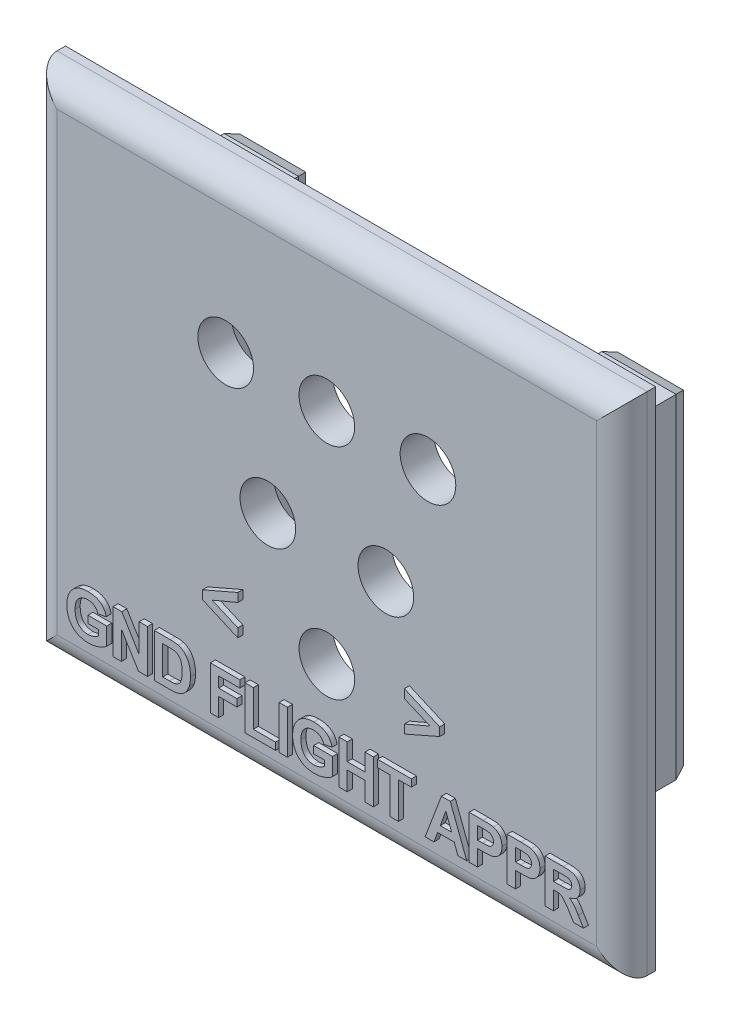
from build123d import *
from OCP.BRepFilletAPI import BRepFilletAPI_MakeChamfer

# Parameters (mm, degrees)
SKETCH2_W           = 53.6
SKETCH2_H           = 39.6
BOSS_EXTRUDE1_DEPTH = 12
SKETCH3_W           = 70
SKETCH3_H           = 60
BOSS_EXTRUDE2_DEPTH = 4
SKETCH4_R           = 2.1
CUT_EXTRUDE1_DEPTH  = 63.93679369
SKETCH5_W           = 36
SKETCH5_H           = 39.6
CUT_EXTRUDE2_DEPTH  = 12
CHAMFER1_SIZE       = 0.5
CHAMFER1_SIZE2      = 1.37373871
FILLET1_R           = 3
SKETCH7_R           = 3.3
CUT_EXTRUDE3_DEPTH  = 49.795491595
SKETCH8_W           = 0.987814879
SKETCH8_H           = 5.13663737
BOSS_EXTRUDE3_DEPTH = 0.6
BOSS_EXTRUDE4_DEPTH = 0.6


with BuildPart() as part:
    # Sketch2 → Boss-Extrude1 (new body)
    with BuildSketch(Plane.XY):
        Rectangle(SKETCH2_W, SKETCH2_H)
    extrude(amount=BOSS_EXTRUDE1_DEPTH)

    # Sketch3 → Boss-Extrude2 (add)
    with BuildSketch(Plane.XY.offset(12)):
        Rectangle(SKETCH3_W, SKETCH3_H)
    extrude(amount=BOSS_EXTRUDE2_DEPTH)

    # Sketch4 → Cut-Extrude1 (cut, through all)
    with BuildSketch(Plane(origin=(0, 19.8, 0), x_dir=(1, 0, 0), z_dir=(0, 1, 0))):
        with Locations(Location((22.5, -4.6, 0), (0, 0, 180))):
            Circle(SKETCH4_R)
        with Locations(Location((-22.5, -4.6, 0), (0, 0, 180))):
            Circle(SKETCH4_R)
    extrude(amount=-CUT_EXTRUDE1_DEPTH, mode=Mode.SUBTRACT)

    # Sketch5 → Cut-Extrude2 (cut)
    with BuildSketch(Plane(origin=(0, 0, 0), x_dir=(-1, 0, 0), z_dir=(0, 0, -1))):
        Rectangle(SKETCH5_W, SKETCH5_H)
    extrude(amount=-CUT_EXTRUDE2_DEPTH, mode=Mode.SUBTRACT)

    # Chamfer1: one chamfer whose edges measure the first distance from different faces: ONE call of the kernel's chamfer builder (chamfer() names one face for all edges)
    chamfer1_edges_1 = [part.edges().sort_by_distance(p)[0] for p in [
        (-22.4, 19.8, 0),
        (-18, 0, 0),
        (-22.4, -19.8, 0),
        (-26.8, 0, 0),
    ]]
    chamfer1_side_1 = [part.faces().sort_by_distance(p)[0] for p in [
        (-22.4, 0, 0),
    ]]
    chamfer1_edges_2 = [part.edges().sort_by_distance(p)[0] for p in [
        (22.4, -19.8, 0),
        (18, 0, 0),
        (22.4, 19.8, 0),
        (26.8, 0, 0),
    ]]
    chamfer1_side_2 = [part.faces().sort_by_distance(p)[0] for p in [
        (22.4, 0, 0),
    ]]
    chamfer1 = BRepFilletAPI_MakeChamfer(part.part.solid().wrapped)
    for e in chamfer1_edges_1:
        chamfer1.Add(CHAMFER1_SIZE, CHAMFER1_SIZE2, e.wrapped, chamfer1_side_1[0].wrapped)  # the first distance lies on this face
    for e in chamfer1_edges_2:
        chamfer1.Add(CHAMFER1_SIZE, CHAMFER1_SIZE2, e.wrapped, chamfer1_side_2[0].wrapped)  # the first distance lies on this face
    add(Compound.cast(chamfer1.Shape()), mode=Mode.REPLACE)

    # Fillet1
    fillet1_edges = [part.edges().sort_by_distance(p)[0] for p in [
        (-35, 0, 16),
        (0, -30, 16),
        (35, 0, 16),
        (0, 30, 16),
    ]]
    fillet(fillet1_edges, radius=FILLET1_R)

    # Sketch7 → Cut-Extrude3 (cut, through all)
    with BuildSketch(Plane.XY.offset(16)):
        with Locations((0, 12)):
            Circle(SKETCH7_R)
        with Locations((-12, 12)):
            Circle(SKETCH7_R)
        with Locations((12, 12)):
            Circle(SKETCH7_R)
        with Locations((-7, -2)):
            Circle(SKETCH7_R)
        with Locations((7, -2)):
            Circle(SKETCH7_R)
        with Locations((0, -14)):
            Circle(SKETCH7_R)
    extrude(amount=-CUT_EXTRUDE3_DEPTH, mode=Mode.SUBTRACT)

    # Sketch8 → Boss-Extrude3 (add)
    # profile 1 of 13: a face of its own
    with BuildSketch(Plane.XY.offset(16)):
        with BuildLine():
            Line((-27.744427229, -23.396296304), (-27.744427229, -22.540190076))
            Line((-27.744427229, -22.540190076), (-25.505380171, -22.540190076))
            Line((-25.505380171, -22.540190076), (-25.505380171, -24.604311583))
            add(Edge.make_bspline(
                [(-25.505380171, -24.604311583), (-25.533559843, -24.629686695), (-25.591164795, -24.681558559), (-25.685153774, -24.754710862), (-25.788626788, -24.82454927), (-25.900958318, -24.892488188), (-26.022380836, -24.957980806), (-26.152410045, -25.02193927), (-26.291285854, -25.083738088), (-26.487676551, -25.161153742), (-26.740471637, -25.245388371), (-27.049518684, -25.318633118), (-27.361010494, -25.363557013), (-27.569356657, -25.369138195), (-27.673428035, -25.371926062)],
                knots=[0, 0, 0, 0, 0.581799769, 1.189316438, 1.825828404, 2.496525428, 3.203088405, 3.942228803, 4.719818701, 5.534979611, 7.181138583, 8.803804008, 10.403462225, 12, 12, 12, 12], degree=3))
            add(Edge.make_bspline(
                [(-27.673428035, -25.371926062), (-27.738625354, -25.370946336), (-27.867148662, -25.369015004), (-28.05687835, -25.353469804), (-28.240044276, -25.32687204), (-28.416795708, -25.28920833), (-28.587730934, -25.243805577), (-28.75213744, -25.185887339), (-28.909431529, -25.11636112), (-29.06103829, -25.038888507), (-29.204131407, -24.949904906), (-29.338849114, -24.852564786), (-29.464216345, -24.74602147), (-29.579783662, -24.630060197), (-29.687098685, -24.505479616), (-29.78490929, -24.371685649), (-29.872623978, -24.228523835), (-29.951325468, -24.077789983), (-30.021341557, -23.920809753), (-30.080422868, -23.758818661), (-30.132219552, -23.594168641), (-30.174790766, -23.426281642), (-30.206057241, -23.254611836), (-30.230363158, -23.07995353), (-30.243417793, -22.901215446), (-30.245725794, -22.780988404), (-30.246891589, -22.720260497)],
                knots=[0, 0, 0, 0, 1.124918047, 2.217548049, 3.282233239, 4.316494221, 5.334437038, 6.332151046, 7.320712088, 8.300141923, 9.267552434, 10.225301062, 11.165776911, 12.103230934, 13.047553934, 14.000517593, 14.959782875, 15.941944936, 16.932894943, 17.923491392, 18.915624898, 19.910402922, 20.909870877, 21.92519501, 22.95199481, 24, 24, 24, 24], degree=3))
            add(Edge.make_bspline(
                [(-30.246891589, -22.720260497), (-30.245946144, -22.654715766), (-30.244082263, -22.525498775), (-30.228018222, -22.334517564), (-30.203072667, -22.14913281), (-30.165244364, -21.969681072), (-30.119222425, -21.795327012), (-30.063055262, -21.626185452), (-29.994238091, -21.463509565), (-29.917685248, -21.305908113), (-29.830540074, -21.155560563), (-29.73207093, -21.014395368), (-29.625191784, -20.880988723), (-29.507790618, -20.757459679), (-29.380280863, -20.64386843), (-29.243958722, -20.538958736), (-29.099150654, -20.440922082), (-28.995507605, -20.385644404), (-28.943181744, -20.357736578)],
                knots=[0, 0, 0, 0, 1.105010302, 2.178452875, 3.229459892, 4.257086284, 5.268538906, 6.268935615, 7.259234261, 8.24469117, 9.221745683, 10.185929258, 11.144249683, 12.101504986, 13.055838221, 14.020611351, 15.000673771, 16, 16, 16, 16], degree=3))
            add(Edge.make_bspline(
                [(-28.943181744, -20.357736578), (-28.901655779, -20.337117391), (-28.817313136, -20.295238129), (-28.683123639, -20.245237234), (-28.542780009, -20.199741275), (-28.394163364, -20.16579571), (-28.238282928, -20.137906806), (-28.075207785, -20.117094358), (-27.904413298, -20.106164939), (-27.78834421, -20.104454612), (-27.728992622, -20.103580042)],
                knots=[0, 0, 0, 0, 0.887969848, 1.803539625, 2.741143579, 3.713741423, 4.722068772, 5.775476617, 6.8624965, 8, 8, 8, 8], degree=3))
            add(Edge.make_bspline(
                [(-27.728992622, -20.103580042), (-27.652469567, -20.10471986), (-27.503646374, -20.106936595), (-27.286673301, -20.125407706), (-27.082473285, -20.157242058), (-26.890761963, -20.201086624), (-26.711952343, -20.257459098), (-26.546352239, -20.326762248), (-26.392945238, -20.407601366), (-26.253953255, -20.50321626), (-26.126551462, -20.608642869), (-26.011072311, -20.724009431), (-25.907469322, -20.849486829), (-25.815673953, -20.984443694), (-25.736408695, -21.129437859), (-25.668255713, -21.283146944), (-25.612157557, -21.44673786), (-25.585046562, -21.560348853), (-25.571234496, -21.618229522)],
                knots=[0, 0, 0, 0, 1.271135529, 2.472123572, 3.614091059, 4.701890498, 5.736279567, 6.724681829, 7.680621489, 8.611506429, 9.52200816, 10.424540711, 11.318996785, 12.221421405, 13.131851814, 14.060431888, 15.011860567, 16, 16, 16, 16], degree=3))
            Line((-25.571234496, -21.618229522), (-26.559049375, -21.815792498))
            add(Edge.make_bspline(
                [(-26.559049375, -21.815792498), (-26.568830617, -21.783377757), (-26.588128825, -21.719424078), (-26.625539665, -21.627622787), (-26.668628739, -21.541323503), (-26.717499405, -21.45990158), (-26.772643997, -21.38385829), (-26.835394803, -21.314013912), (-26.901804426, -21.247182564), (-26.976210034, -21.188016012), (-27.055520465, -21.134677634), (-27.138842061, -21.086580217), (-27.228057536, -21.047574552), (-27.321917209, -21.016190251), (-27.419962332, -20.989536699), (-27.523472433, -20.973144662), (-27.631285112, -20.960781898), (-27.704944622, -20.960055391), (-27.742369282, -20.95968627)],
                knots=[0, 0, 0, 0, 1.027736275, 2.027704492, 3.005900071, 3.954421694, 4.908588141, 5.853155543, 6.803277083, 7.766271258, 8.734041521, 9.704274878, 10.683578894, 11.68490234, 12.708089448, 13.76461009, 14.864251086, 16, 16, 16, 16], degree=3))
            add(Edge.make_bspline(
                [(-27.742369282, -20.95968627), (-27.799012815, -20.961197538), (-27.909557497, -20.964146906), (-28.070938001, -20.983392168), (-28.223185701, -21.017631255), (-28.366698716, -21.064857546), (-28.501740147, -21.125475798), (-28.626485166, -21.201746945), (-28.744039849, -21.289157906), (-28.851059001, -21.391748663), (-28.948113212, -21.506782216), (-29.032130993, -21.635630668), (-29.102075436, -21.777877528), (-29.159363921, -21.932808533), (-29.204977779, -22.100430141), (-29.235921643, -22.281335739), (-29.256139801, -22.475247795), (-29.258077649, -22.609076791), (-29.25907671, -22.67807257)],
                knots=[0, 0, 0, 0, 1.043810997, 2.037086103, 2.989314757, 3.91471467, 4.817033861, 5.710208705, 6.603920097, 7.511448416, 8.435617211, 9.371747005, 10.338444094, 11.350425613, 12.411431869, 13.5347293, 14.729025275, 16, 16, 16, 16], degree=3))
            add(Edge.make_bspline(
                [(-29.25907671, -22.67807257), (-29.258034893, -22.752203746), (-29.25601006, -22.896282015), (-29.236321866, -23.105042113), (-29.203934614, -23.299540026), (-29.157480667, -23.479530422), (-29.099027135, -23.64565188), (-29.028763375, -23.798435082), (-28.942049404, -23.935044965), (-28.844373528, -24.058219839), (-28.735201703, -24.165849271), (-28.617595321, -24.259683546), (-28.492209145, -24.339204691), (-28.357886926, -24.403157488), (-28.216322773, -24.454065562), (-28.066215234, -24.489755657), (-27.908011266, -24.511925029), (-27.799723587, -24.514503272), (-27.744427229, -24.515819834)],
                knots=[0, 0, 0, 0, 1.318042826, 2.561693173, 3.724929596, 4.821196409, 5.862977565, 6.853497791, 7.804600806, 8.73339865, 9.643480846, 10.524649628, 11.404635349, 12.277659519, 13.165160235, 14.075017549, 15.017020959, 16, 16, 16, 16], degree=3))
            add(Edge.make_bspline(
                [(-27.744427229, -24.515819834), (-27.688420236, -24.514263015), (-27.575870467, -24.511134484), (-27.40729181, -24.484623351), (-27.238053573, -24.445611367), (-27.072127594, -24.386761063), (-26.910985566, -24.319260179), (-26.760542273, -24.241466602), (-26.619656765, -24.160376994), (-26.534827277, -24.097175841), (-26.49319505, -24.066158269)],
                knots=[0, 0, 0, 0, 0.993821502, 1.997150276, 3.023717651, 4.073291794, 5.118404464, 6.123376694, 7.078999408, 8, 8, 8, 8], degree=3))
            Line((-26.49319505, -24.066158269), (-26.49319505, -23.396296304))
            Line((-26.49319505, -23.396296304), (-27.744427229, -23.396296304))
        make_face()
    # profile 2 of 13: a face of its own
    with BuildSketch(Plane.XY.offset(16)):
        Polygon((-24.754640863, -25.306071737), (-24.754640863, -20.169434367), (-23.722580109, -20.169434367), (-21.659487576, -23.546526484), (-21.659487576, -20.169434367), (-20.671672697, -20.169434367), (-20.671672697, -25.306071737), (-21.73563164, -25.306071737), (-23.766825984, -21.982486259), (-23.766825984, -25.306071737), align=None)
    # profile 3 of 13: a face of its own
    with BuildSketch(Plane.XY.offset(16)):
        with BuildLine():
            Line((-19.855079064, -20.169434367), (-17.971027977, -20.169434367))
            add(Edge.make_bspline(
                [(-17.971027977, -20.169434367), (-17.919571484, -20.169407691), (-17.819373737, -20.169355748), (-17.673960574, -20.175388282), (-17.537980573, -20.181456218), (-17.411824028, -20.193602899), (-17.295053264, -20.206334774), (-17.187458741, -20.222454286), (-17.089720138, -20.243113205), (-17.02808623, -20.259405234), (-16.998647706, -20.267186881)],
                knots=[0, 0, 0, 0, 1.259756885, 2.453039283, 3.563158368, 4.591894114, 5.55549294, 6.43918076, 7.254497783, 8, 8, 8, 8], degree=3))
            add(Edge.make_bspline(
                [(-16.998647706, -20.267186881), (-16.961833033, -20.279185357), (-16.888866806, -20.302966189), (-16.781896073, -20.344634166), (-16.680546873, -20.396310861), (-16.581059271, -20.450632681), (-16.487874679, -20.514861914), (-16.396061584, -20.581683834), (-16.31157851, -20.659090038), (-16.200789822, -20.767270304), (-16.074371509, -20.917968837), (-15.941929061, -21.117862868), (-15.829829711, -21.337274069), (-15.753238281, -21.533858865), (-15.701520773, -21.700972547), (-15.667713603, -21.834955346), (-15.638996468, -21.976089137), (-15.615419612, -22.124409499), (-15.597101073, -22.279916452), (-15.583462726, -22.442568549), (-15.576819475, -22.612506297), (-15.575315334, -22.728145023), (-15.574547923, -22.787143796)],
                knots=[0, 0, 0, 0, 0.745524535, 1.477620414, 2.207090574, 2.934465325, 3.657932502, 4.384347339, 5.118673636, 5.861150177, 7.365375624, 8.894729774, 10.468936425, 12.099947606, 12.950091786, 13.83580991, 14.759228729, 15.722225242, 16.726454549, 17.773376212, 18.863978586, 20, 20, 20, 20], degree=3))
            add(Edge.make_bspline(
                [(-15.574547923, -22.787143796), (-15.575948801, -22.889111783), (-15.578658071, -23.086315823), (-15.610045142, -23.37088043), (-15.655277877, -23.635189312), (-15.706264551, -23.800076684), (-15.730951945, -23.879914005)],
                knots=[0, 0, 0, 0, 1.103207939, 2.133582005, 3.096293362, 4, 4, 4, 4], degree=3))
            add(Edge.make_bspline(
                [(-15.730951945, -23.879914005), (-15.747253805, -23.925726401), (-15.779322106, -24.015846529), (-15.835439229, -24.145845257), (-15.896074177, -24.269558274), (-15.961729892, -24.386888108), (-16.032738087, -24.497307009), (-16.109364355, -24.600484705), (-16.190420932, -24.697779564), (-16.249141732, -24.75766501), (-16.278366024, -24.787468925)],
                knots=[0, 0, 0, 0, 1.090884612, 2.145940218, 3.175104604, 4.181306866, 5.161203701, 6.118658341, 7.063689906, 8, 8, 8, 8], degree=3))
            add(Edge.make_bspline(
                [(-16.278366024, -24.787468925), (-16.325657989, -24.829998961), (-16.423180762, -24.917701958), (-16.59503259, -25.026237921), (-16.78927348, -25.122143281), (-16.929775463, -25.171408273), (-17.002763601, -25.19700051)],
                knots=[0, 0, 0, 0, 0.908140292, 1.872714733, 2.8949153, 4, 4, 4, 4], degree=3))
            add(Edge.make_bspline(
                [(-17.002763601, -25.19700051), (-17.032145031, -25.206024423), (-17.093124669, -25.224753085), (-17.189813898, -25.244755685), (-17.293032075, -25.265828621), (-17.403969449, -25.278523282), (-17.521474437, -25.291910365), (-17.646483446, -25.299426464), (-17.778563134, -25.304762457), (-17.869153353, -25.305628839), (-17.915463391, -25.306071737)],
                knots=[0, 0, 0, 0, 0.799129865, 1.658552685, 2.566799617, 3.538529252, 4.561352959, 5.643373779, 6.795284424, 8, 8, 8, 8], degree=3))
            Line((-17.915463391, -25.306071737), (-19.855079064, -25.306071737))
            Line((-19.855079064, -25.306071737), (-19.855079064, -20.169434367))
        make_face()
        with BuildLine():
            Line((-18.867264185, -21.025540595), (-18.867264185, -24.449965508))
            Line((-18.867264185, -24.449965508), (-18.054374858, -24.449965508))
            add(Edge.make_bspline(
                [(-18.054374858, -24.449965508), (-18.017675036, -24.449674454), (-17.947013858, -24.449114062), (-17.844765325, -24.44746742), (-17.750799783, -24.443009647), (-17.664624984, -24.438392121), (-17.586465273, -24.43076316), (-17.515980565, -24.423259786), (-17.453563213, -24.412762723), (-17.415012723, -24.404476481), (-17.396860579, -24.400574764)],
                knots=[0, 0, 0, 0, 1.333384787, 2.567275092, 3.714769766, 4.750907381, 5.701951617, 6.567520054, 7.325492842, 8, 8, 8, 8], degree=3))
            add(Edge.make_bspline(
                [(-17.396860579, -24.400574764), (-17.354346201, -24.389229819), (-17.271539406, -24.367132859), (-17.155270295, -24.317872374), (-17.050061729, -24.258444988), (-16.954151787, -24.186986111), (-16.867717076, -24.096678619), (-16.793934483, -23.981182417), (-16.725650639, -23.843436903), (-16.678889846, -23.711579998), (-16.645325039, -23.593808495), (-16.622604418, -23.494959965), (-16.604648926, -23.388015851), (-16.58920486, -23.273398224), (-16.576725688, -23.151254475), (-16.568960557, -23.021143523), (-16.563660807, -22.883224636), (-16.562803666, -22.788521148), (-16.562362801, -22.739810999)],
                knots=[0, 0, 0, 0, 1.038686998, 2.023088296, 2.974059649, 3.888265163, 4.839857954, 5.909819677, 7.113156087, 8.466843969, 9.20827164, 10.006482943, 10.861893492, 11.769681931, 12.739021491, 13.762258324, 14.849031541, 16, 16, 16, 16], degree=3))
            add(Edge.make_bspline(
                [(-16.562362801, -22.739810999), (-16.562800276, -22.691100702), (-16.563647746, -22.596739678), (-16.568939368, -22.459849179), (-16.576660882, -22.331787113), (-16.589228926, -22.212395172), (-16.604433583, -22.101508351), (-16.622599394, -21.999032812), (-16.645183052, -21.905641071), (-16.678776408, -21.794689959), (-16.729702207, -21.669977461), (-16.799002279, -21.533623562), (-16.884105154, -21.417405293), (-16.978135543, -21.316444583), (-17.086554171, -21.233359021), (-17.20657333, -21.163770023), (-17.34080618, -21.109757777), (-17.436290223, -21.086752189), (-17.485352329, -21.074931339)],
                knots=[0, 0, 0, 0, 1.117996097, 2.165769068, 3.143980016, 4.062055362, 4.920439205, 5.712587309, 6.449616741, 7.124491204, 8.371470382, 9.537068822, 10.625202851, 11.666538334, 12.693249444, 13.747832046, 14.842779399, 16, 16, 16, 16], degree=3))
            add(Edge.make_bspline(
                [(-17.485352329, -21.074931339), (-17.506588798, -21.070985306), (-17.553343375, -21.062297651), (-17.630928097, -21.052150419), (-17.721952262, -21.044620307), (-17.826879895, -21.036932723), (-17.945286135, -21.032544892), (-18.077666421, -21.027965477), (-18.223466806, -21.026401158), (-18.325338332, -21.025835692), (-18.378501615, -21.025540595)],
                knots=[0, 0, 0, 0, 0.578738571, 1.274160813, 2.095454135, 3.025967819, 4.093109015, 5.270126069, 6.575371698, 8, 8, 8, 8], degree=3))
            Line((-18.378501615, -21.025540595), (-18.867264185, -21.025540595))
        make_face(mode=Mode.SUBTRACT)
    # profile 4 of 13: a face of its own
    with BuildSketch(Plane.XY.offset(16)):
        Polygon((-13.216963078, -25.306071737), (-13.216963078, -20.169434367), (-9.72668384, -20.169434367), (-9.72668384, -21.025540595), (-12.2291482, -21.025540595), (-12.2291482, -22.276772775), (-10.055955466, -22.276772775), (-10.055955466, -23.132879003), (-12.2291482, -23.132879003), (-12.2291482, -25.306071737), align=None)
    # profile 5 of 13: a face of its own
    with BuildSketch(Plane.XY.offset(16)):
        Polygon((-9.107653183, -25.306071737), (-9.107653183, -20.169434367), (-8.119838304, -20.169434367), (-8.119838304, -24.449965508), (-5.485665294, -24.449965508), (-5.485665294, -25.306071737), align=None)
    # profile 6 of 13: a face of its own
    with BuildSketch(Plane.XY.offset(16)):
        with Locations((-4.570290173, -22.737753052)):
            Rectangle(SKETCH8_W, SKETCH8_H)
    # profile 7 of 13: a face of its own
    with BuildSketch(Plane.XY.offset(16)):
        with BuildLine():
            Line((-0.954887716, -23.396296304), (-0.954887716, -22.540190076))
            Line((-0.954887716, -22.540190076), (1.284159342, -22.540190076))
            Line((1.284159342, -22.540190076), (1.284159342, -24.604311583))
            add(Edge.make_bspline(
                [(1.284159342, -24.604311583), (1.25597967, -24.629686695), (1.198374718, -24.681558559), (1.104385739, -24.754710862), (1.000912726, -24.82454927), (0.888581195, -24.892488188), (0.767158677, -24.957980806), (0.637129468, -25.02193927), (0.498253659, -25.083738088), (0.301862962, -25.161153742), (0.049067876, -25.245388371), (-0.259979171, -25.318633118), (-0.57147098, -25.363557013), (-0.779817144, -25.369138195), (-0.883888522, -25.371926062)],
                knots=[0, 0, 0, 0, 0.581799769, 1.189316438, 1.825828404, 2.496525428, 3.203088405, 3.942228803, 4.719818701, 5.534979611, 7.181138583, 8.803804008, 10.403462225, 12, 12, 12, 12], degree=3))
            add(Edge.make_bspline(
                [(-0.883888522, -25.371926062), (-0.949085841, -25.370946336), (-1.077609149, -25.369015004), (-1.267338836, -25.353469804), (-1.450504763, -25.32687204), (-1.627256194, -25.28920833), (-1.798191421, -25.243805577), (-1.962597927, -25.185887339), (-2.119892016, -25.11636112), (-2.271498777, -25.038888507), (-2.414591894, -24.949904906), (-2.549309601, -24.852564786), (-2.674676831, -24.74602147), (-2.790244149, -24.630060197), (-2.897559172, -24.505479616), (-2.995369776, -24.371685649), (-3.083084464, -24.228523835), (-3.161785955, -24.077789983), (-3.231802043, -23.920809753), (-3.290883354, -23.758818661), (-3.342680039, -23.594168641), (-3.385251253, -23.426281642), (-3.416517728, -23.254611836), (-3.440823645, -23.07995353), (-3.45387828, -22.901215446), (-3.456186281, -22.780988404), (-3.457352076, -22.720260497)],
                knots=[0, 0, 0, 0, 1.124918047, 2.217548049, 3.282233239, 4.316494221, 5.334437038, 6.332151046, 7.320712088, 8.300141923, 9.267552434, 10.225301062, 11.165776911, 12.103230934, 13.047553934, 14.000517593, 14.959782875, 15.941944936, 16.932894943, 17.923491392, 18.915624898, 19.910402922, 20.909870877, 21.92519501, 22.95199481, 24, 24, 24, 24], degree=3))
            add(Edge.make_bspline(
                [(-3.457352076, -22.720260497), (-3.456406631, -22.654715766), (-3.45454275, -22.525498775), (-3.438478709, -22.334517564), (-3.413533154, -22.14913281), (-3.375704851, -21.969681072), (-3.329682911, -21.795327012), (-3.273515749, -21.626185452), (-3.204698578, -21.463509565), (-3.128145734, -21.305908113), (-3.041000561, -21.155560563), (-2.942531416, -21.014395368), (-2.83565227, -20.880988723), (-2.718251105, -20.757459679), (-2.59074135, -20.64386843), (-2.454419208, -20.538958736), (-2.30961114, -20.440922082), (-2.205968092, -20.385644404), (-2.153642231, -20.357736578)],
                knots=[0, 0, 0, 0, 1.105010302, 2.178452875, 3.229459892, 4.257086284, 5.268538906, 6.268935615, 7.259234261, 8.24469117, 9.221745683, 10.185929258, 11.144249683, 12.101504986, 13.055838221, 14.020611351, 15.000673771, 16, 16, 16, 16], degree=3))
            add(Edge.make_bspline(
                [(-2.153642231, -20.357736578), (-2.112116265, -20.337117391), (-2.027773622, -20.295238129), (-1.893584126, -20.245237234), (-1.753240496, -20.199741275), (-1.604623851, -20.16579571), (-1.448743415, -20.137906806), (-1.285668271, -20.117094358), (-1.114873785, -20.106164939), (-0.998804696, -20.104454612), (-0.939453109, -20.103580042)],
                knots=[0, 0, 0, 0, 0.887969848, 1.803539625, 2.741143579, 3.713741423, 4.722068772, 5.775476617, 6.8624965, 8, 8, 8, 8], degree=3))
            add(Edge.make_bspline(
                [(-0.939453109, -20.103580042), (-0.862930054, -20.10471986), (-0.714106861, -20.106936595), (-0.497133787, -20.125407706), (-0.292933772, -20.157242058), (-0.10122245, -20.201086624), (0.077587171, -20.257459098), (0.243187274, -20.326762248), (0.396594275, -20.407601366), (0.535586259, -20.50321626), (0.662988051, -20.608642869), (0.778467202, -20.724009431), (0.882070191, -20.849486829), (0.97386556, -20.984443694), (1.053130818, -21.129437859), (1.1212838, -21.283146944), (1.177381956, -21.44673786), (1.204492951, -21.560348853), (1.218305017, -21.618229522)],
                knots=[0, 0, 0, 0, 1.271135529, 2.472123572, 3.614091059, 4.701890498, 5.736279567, 6.724681829, 7.680621489, 8.611506429, 9.52200816, 10.424540711, 11.318996785, 12.221421405, 13.131851814, 14.060431888, 15.011860567, 16, 16, 16, 16], degree=3))
            Line((1.218305017, -21.618229522), (0.230490138, -21.815792498))
            add(Edge.make_bspline(
                [(0.230490138, -21.815792498), (0.220708896, -21.783377757), (0.201410688, -21.719424078), (0.163999848, -21.627622787), (0.120910774, -21.541323503), (0.072040109, -21.45990158), (0.016895516, -21.38385829), (-0.04585529, -21.314013912), (-0.112264913, -21.247182564), (-0.186670521, -21.188016012), (-0.265980952, -21.134677634), (-0.349302548, -21.086580217), (-0.438518023, -21.047574552), (-0.532377696, -21.016190251), (-0.630422819, -20.989536699), (-0.73393292, -20.973144662), (-0.841745599, -20.960781898), (-0.915405108, -20.960055391), (-0.952829769, -20.95968627)],
                knots=[0, 0, 0, 0, 1.027736275, 2.027704492, 3.005900071, 3.954421694, 4.908588141, 5.853155543, 6.803277083, 7.766271258, 8.734041521, 9.704274878, 10.683578894, 11.68490234, 12.708089448, 13.76461009, 14.864251086, 16, 16, 16, 16], degree=3))
            add(Edge.make_bspline(
                [(-0.952829769, -20.95968627), (-1.009473302, -20.961197538), (-1.120017984, -20.964146906), (-1.281398487, -20.983392168), (-1.433646188, -21.017631255), (-1.577159202, -21.064857546), (-1.712200634, -21.125475798), (-1.836945653, -21.201746945), (-1.954500336, -21.289157906), (-2.061519488, -21.391748663), (-2.158573699, -21.506782216), (-2.24259148, -21.635630668), (-2.312535923, -21.777877528), (-2.369824408, -21.932808533), (-2.415438266, -22.100430141), (-2.44638213, -22.281335739), (-2.466600287, -22.475247795), (-2.468538136, -22.609076791), (-2.469537197, -22.67807257)],
                knots=[0, 0, 0, 0, 1.043810997, 2.037086103, 2.989314757, 3.91471467, 4.817033861, 5.710208705, 6.603920097, 7.511448416, 8.435617211, 9.371747005, 10.338444094, 11.350425613, 12.411431869, 13.5347293, 14.729025275, 16, 16, 16, 16], degree=3))
            add(Edge.make_bspline(
                [(-2.469537197, -22.67807257), (-2.46849538, -22.752203746), (-2.466470547, -22.896282015), (-2.446782352, -23.105042113), (-2.414395101, -23.299540026), (-2.367941154, -23.479530422), (-2.309487621, -23.64565188), (-2.239223862, -23.798435082), (-2.15250989, -23.935044965), (-2.054834015, -24.058219839), (-1.94566219, -24.165849271), (-1.828055808, -24.259683546), (-1.702669632, -24.339204691), (-1.568347413, -24.403157488), (-1.426783259, -24.454065562), (-1.276675721, -24.489755657), (-1.118471753, -24.511925029), (-1.010184074, -24.514503272), (-0.954887716, -24.515819834)],
                knots=[0, 0, 0, 0, 1.318042826, 2.561693173, 3.724929596, 4.821196409, 5.862977565, 6.853497791, 7.804600806, 8.73339865, 9.643480846, 10.524649628, 11.404635349, 12.277659519, 13.165160235, 14.075017549, 15.017020959, 16, 16, 16, 16], degree=3))
            add(Edge.make_bspline(
                [(-0.954887716, -24.515819834), (-0.898880723, -24.514263015), (-0.786330953, -24.511134484), (-0.617752297, -24.484623351), (-0.44851406, -24.445611367), (-0.282588081, -24.386761063), (-0.121446053, -24.319260179), (0.02899724, -24.241466602), (0.169882748, -24.160376994), (0.254712236, -24.097175841), (0.296344464, -24.066158269)],
                knots=[0, 0, 0, 0, 0.993821502, 1.997150276, 3.023717651, 4.073291794, 5.118404464, 6.123376694, 7.078999408, 8, 8, 8, 8], degree=3))
            Line((0.296344464, -24.066158269), (0.296344464, -23.396296304))
            Line((0.296344464, -23.396296304), (-0.954887716, -23.396296304))
        make_face()
    # profile 8 of 13: a face of its own
    with BuildSketch(Plane.XY.offset(16)):
        Polygon((2.03489865, -25.306071737), (2.03489865, -20.169434367), (3.022713529, -20.169434367), (3.022713529, -22.21091845), (5.130051937, -22.21091845), (5.130051937, -20.169434367), (6.117866816, -20.169434367), (6.117866816, -25.306071737), (5.130051937, -25.306071737), (5.130051937, -23.067024678), (3.022713529, -23.067024678), (3.022713529, -25.306071737), align=None)
    # profile 9 of 13: a face of its own
    with BuildSketch(Plane.XY.offset(16)):
        Polygon((8.119838304, -25.306071737), (8.119838304, -21.025540595), (6.605188823, -21.025540595), (6.605188823, -20.169434367), (10.622302663, -20.169434367), (10.622302663, -21.025540595), (9.107653183, -21.025540595), (9.107653183, -25.306071737), align=None)
    # profile 10 of 13: a face of its own
    with BuildSketch(Plane.XY.offset(16)):
        Polygon((17.194564324, -25.306071737), (16.147068963, -25.306071737), (15.713870979, -24.120693882), (13.742357117, -24.120693882), (13.309159134, -25.306071737), (12.25548993, -25.306071737), (14.197163551, -20.169434367), (15.243629938, -20.169434367), align=None)
        Polygon((15.400033961, -23.264587654), (14.725027127, -21.420666547), (14.052078241, -23.264587654), align=None, mode=Mode.SUBTRACT)
    # profile 11 of 13: a face of its own
    with BuildSketch(Plane.XY.offset(16)):
        with BuildLine():
            Line((17.484323355, -25.306071737), (17.484323355, -20.169434367))
            Line((17.484323355, -20.169434367), (19.127594565, -20.169434367))
            add(Edge.make_bspline(
                [(19.127594565, -20.169434367), (19.202026105, -20.16951565), (19.344385274, -20.169671113), (19.547452017, -20.173990524), (19.730283197, -20.180105128), (19.892607462, -20.187720608), (20.034995989, -20.199084366), (20.15681004, -20.212243428), (20.258816668, -20.226399086), (20.31888535, -20.241048299), (20.345899582, -20.247636378)],
                knots=[0, 0, 0, 0, 1.460485487, 2.793352117, 3.985295279, 5.050041172, 5.981765236, 6.787433016, 7.454681457, 8, 8, 8, 8], degree=3))
            add(Edge.make_bspline(
                [(20.345899582, -20.247636378), (20.381821941, -20.257879227), (20.453119409, -20.278208883), (20.555266447, -20.321548479), (20.653720016, -20.371776759), (20.747243153, -20.431639789), (20.836153773, -20.500074791), (20.920716159, -20.576523666), (21.001381269, -20.661331522), (21.077033205, -20.754330825), (21.14632148, -20.855052625), (21.206203958, -20.963645836), (21.256372954, -21.079638458), (21.299116104, -21.202158819), (21.330652205, -21.332520537), (21.352721742, -21.469817844), (21.368084893, -21.61411079), (21.369172652, -21.712853114), (21.369728545, -21.763314833)],
                knots=[0, 0, 0, 0, 0.907145743, 1.80047177, 2.69161667, 3.591261238, 4.495029544, 5.415863088, 6.359363025, 7.337192411, 8.326890979, 9.326929023, 10.346104993, 11.395420813, 12.477187422, 13.601053412, 14.774031606, 16, 16, 16, 16], degree=3))
            add(Edge.make_bspline(
                [(21.369728545, -21.763314833), (21.368143141, -21.83994669), (21.365091151, -21.987467223), (21.330944799, -22.198955787), (21.278863212, -22.392136957), (21.202742209, -22.565149996), (21.109934894, -22.718673838), (21.007705726, -22.857074856), (20.890975039, -22.976181503), (20.764857828, -23.077915943), (20.631574987, -23.161171188), (20.498050877, -23.232145102), (20.362483784, -23.286712115), (20.270054443, -23.310487401), (20.22448067, -23.322210188)],
                knots=[0, 0, 0, 0, 1.312386234, 2.526415563, 3.661883817, 4.733421185, 5.753802465, 6.732107337, 7.675884281, 8.604170108, 9.50284679, 10.365392406, 11.194030444, 12, 12, 12, 12], degree=3))
            add(Edge.make_bspline(
                [(20.22448067, -23.322210188), (20.191952346, -23.32839784), (20.12338652, -23.341440672), (20.014645221, -23.354442001), (19.895785089, -23.368833055), (19.766317242, -23.378219708), (19.626398305, -23.387009916), (19.476082606, -23.391160064), (19.315584965, -23.396160148), (19.205115547, -23.396249994), (19.148174041, -23.396296304)],
                knots=[0, 0, 0, 0, 0.735353946, 1.55003838, 2.431865514, 3.394945452, 4.432993119, 5.54609699, 6.735134699, 8, 8, 8, 8], degree=3))
            Line((19.148174041, -23.396296304), (18.472138234, -23.396296304))
            Line((18.472138234, -23.396296304), (18.472138234, -25.306071737))
            Line((18.472138234, -25.306071737), (17.484323355, -25.306071737))
        make_face()
        with BuildLine():
            Line((18.472138234, -21.025540595), (18.472138234, -22.540190076))
            Line((18.472138234, -22.540190076), (19.064827161, -22.540190076))
            add(Edge.make_bspline(
                [(19.064827161, -22.540190076), (19.11593735, -22.540123893), (19.213717572, -22.539997276), (19.354010501, -22.535452463), (19.481003793, -22.529904677), (19.594962797, -22.520721955), (19.695199625, -22.508619347), (19.782385539, -22.494143104), (19.856622153, -22.478608583), (19.936898944, -22.452865392), (20.022730884, -22.411215256), (20.114389308, -22.351353549), (20.194911126, -22.279781819), (20.261915951, -22.1957233), (20.315437972, -22.102329416), (20.353759777, -22.000557297), (20.378504131, -21.892093663), (20.380764302, -21.816958093), (20.381913666, -21.77874944)],
                knots=[0, 0, 0, 0, 1.411705958, 2.700771114, 3.876961699, 4.922619712, 5.858038221, 6.66485904, 7.363650596, 7.950905807, 8.989198271, 9.987739806, 10.967313358, 11.951275539, 12.944273208, 13.927870418, 14.946261014, 16, 16, 16, 16], degree=3))
            add(Edge.make_bspline(
                [(20.381913666, -21.77874944), (20.380296063, -21.732211898), (20.377159743, -21.641981739), (20.342574894, -21.513478934), (20.289214424, -21.396861081), (20.212924102, -21.295756687), (20.120767188, -21.210736206), (20.017186662, -21.139996143), (19.899970517, -21.090491709), (19.817012904, -21.071310568), (19.774819105, -21.061554679)],
                knots=[0, 0, 0, 0, 1.085904563, 2.105425768, 3.088705091, 4.068969419, 5.045188284, 6.010769642, 6.988240112, 8, 8, 8, 8], degree=3))
            add(Edge.make_bspline(
                [(19.774819105, -21.061554679), (19.75666215, -21.058650622), (19.716359338, -21.052204516), (19.649367863, -21.045477203), (19.570116937, -21.039358718), (19.478511031, -21.034335259), (19.374913249, -21.030408078), (19.258981877, -21.026966898), (19.131022244, -21.026690445), (19.041502916, -21.025934498), (18.99485694, -21.025540595)],
                knots=[0, 0, 0, 0, 0.564603001, 1.253243608, 2.066786758, 3.005752288, 4.070476343, 5.250658742, 6.567396469, 8, 8, 8, 8], degree=3))
            Line((18.99485694, -21.025540595), (18.472138234, -21.025540595))
        make_face(mode=Mode.SUBTRACT)
    # profile 12 of 13: a face of its own
    with BuildSketch(Plane.XY.offset(16)):
        with BuildLine():
            Line((21.988759202, -25.306071737), (21.988759202, -20.169434367))
            Line((21.988759202, -20.169434367), (23.632030412, -20.169434367))
            add(Edge.make_bspline(
                [(23.632030412, -20.169434367), (23.706461952, -20.16951565), (23.848821121, -20.169671113), (24.051887865, -20.173990524), (24.234719044, -20.180105128), (24.39704331, -20.187720608), (24.539431837, -20.199084366), (24.661245887, -20.212243428), (24.763252515, -20.226399086), (24.823321197, -20.241048299), (24.850335429, -20.247636378)],
                knots=[0, 0, 0, 0, 1.460485487, 2.793352117, 3.985295279, 5.050041172, 5.981765236, 6.787433016, 7.454681457, 8, 8, 8, 8], degree=3))
            add(Edge.make_bspline(
                [(24.850335429, -20.247636378), (24.886257789, -20.257879227), (24.957555256, -20.278208883), (25.059702294, -20.321548479), (25.158155863, -20.371776759), (25.251679001, -20.431639789), (25.34058962, -20.500074791), (25.425152006, -20.576523666), (25.505817116, -20.661331522), (25.581469053, -20.754330825), (25.650757327, -20.855052625), (25.710639805, -20.963645836), (25.760808801, -21.079638458), (25.803551952, -21.202158819), (25.835088052, -21.332520537), (25.857157589, -21.469817844), (25.872520741, -21.61411079), (25.873608499, -21.712853114), (25.874164392, -21.763314833)],
                knots=[0, 0, 0, 0, 0.907145743, 1.80047177, 2.69161667, 3.591261238, 4.495029544, 5.415863088, 6.359363025, 7.337192411, 8.326890979, 9.326929023, 10.346104993, 11.395420813, 12.477187422, 13.601053412, 14.774031606, 16, 16, 16, 16], degree=3))
            add(Edge.make_bspline(
                [(25.874164392, -21.763314833), (25.872578988, -21.83994669), (25.869526998, -21.987467223), (25.835380646, -22.198955787), (25.783299059, -22.392136957), (25.707178057, -22.565149996), (25.614370741, -22.718673838), (25.512141573, -22.857074856), (25.395410886, -22.976181503), (25.269293676, -23.077915943), (25.136010834, -23.161171188), (25.002486724, -23.232145102), (24.866919632, -23.286712115), (24.77449029, -23.310487401), (24.728916517, -23.322210188)],
                knots=[0, 0, 0, 0, 1.312386234, 2.526415563, 3.661883817, 4.733421185, 5.753802465, 6.732107337, 7.675884281, 8.604170108, 9.50284679, 10.365392406, 11.194030444, 12, 12, 12, 12], degree=3))
            add(Edge.make_bspline(
                [(24.728916517, -23.322210188), (24.696388193, -23.32839784), (24.627822367, -23.341440672), (24.519081069, -23.354442001), (24.400220936, -23.368833055), (24.27075309, -23.378219708), (24.130834152, -23.387009916), (23.980518454, -23.391160064), (23.820020812, -23.396160148), (23.709551395, -23.396249994), (23.652609889, -23.396296304)],
                knots=[0, 0, 0, 0, 0.735353946, 1.55003838, 2.431865514, 3.394945452, 4.432993119, 5.54609699, 6.735134699, 8, 8, 8, 8], degree=3))
            Line((23.652609889, -23.396296304), (22.976574081, -23.396296304))
            Line((22.976574081, -23.396296304), (22.976574081, -25.306071737))
            Line((22.976574081, -25.306071737), (21.988759202, -25.306071737))
        make_face()
        with BuildLine():
            Line((22.976574081, -21.025540595), (22.976574081, -22.540190076))
            Line((22.976574081, -22.540190076), (23.569263008, -22.540190076))
            add(Edge.make_bspline(
                [(23.569263008, -22.540190076), (23.620373197, -22.540123893), (23.71815342, -22.539997276), (23.858446349, -22.535452463), (23.985439641, -22.529904677), (24.099398644, -22.520721955), (24.199635472, -22.508619347), (24.286821387, -22.494143104), (24.361058, -22.478608583), (24.441334792, -22.452865392), (24.527166731, -22.411215256), (24.618825156, -22.351353549), (24.699346973, -22.279781819), (24.766351799, -22.1957233), (24.819873819, -22.102329416), (24.858195625, -22.000557297), (24.882939979, -21.892093663), (24.88520015, -21.816958093), (24.886349513, -21.77874944)],
                knots=[0, 0, 0, 0, 1.411705958, 2.700771114, 3.876961699, 4.922619712, 5.858038221, 6.66485904, 7.363650596, 7.950905807, 8.989198271, 9.987739806, 10.967313358, 11.951275539, 12.944273208, 13.927870418, 14.946261014, 16, 16, 16, 16], degree=3))
            add(Edge.make_bspline(
                [(24.886349513, -21.77874944), (24.88473191, -21.732211898), (24.881595591, -21.641981739), (24.847010742, -21.513478934), (24.793650272, -21.396861081), (24.717359949, -21.295756687), (24.625203035, -21.210736206), (24.521622509, -21.139996143), (24.404406364, -21.090491709), (24.321448751, -21.071310568), (24.279254952, -21.061554679)],
                knots=[0, 0, 0, 0, 1.085904563, 2.105425768, 3.088705091, 4.068969419, 5.045188284, 6.010769642, 6.988240112, 8, 8, 8, 8], degree=3))
            add(Edge.make_bspline(
                [(24.279254952, -21.061554679), (24.261097997, -21.058650622), (24.220795185, -21.052204516), (24.15380371, -21.045477203), (24.074552784, -21.039358718), (23.982946879, -21.034335259), (23.879349096, -21.030408078), (23.763417725, -21.026966898), (23.635458092, -21.026690445), (23.545938764, -21.025934498), (23.499292788, -21.025540595)],
                knots=[0, 0, 0, 0, 0.564603001, 1.253243608, 2.066786758, 3.005752288, 4.070476343, 5.250658742, 6.567396469, 8, 8, 8, 8], degree=3))
            Line((23.499292788, -21.025540595), (22.976574081, -21.025540595))
        make_face(mode=Mode.SUBTRACT)
    # profile 13 of 13: a face of its own
    with BuildSketch(Plane.XY.offset(16)):
        with BuildLine():
            Line((26.49319505, -25.306071737), (26.49319505, -20.169434367))
            Line((26.49319505, -20.169434367), (28.648895228, -20.169434367))
            add(Edge.make_bspline(
                [(28.648895228, -20.169434367), (28.714409087, -20.169838127), (28.840666284, -20.170616248), (29.023258823, -20.176290456), (29.19165013, -20.188178252), (29.346587192, -20.20164128), (29.487325833, -20.221229117), (29.61442251, -20.244695153), (29.727663246, -20.271889053), (29.82870029, -20.304458159), (29.92082555, -20.341734632), (30.006644749, -20.386104123), (30.087101495, -20.438088434), (30.163431525, -20.49589581), (30.235958066, -20.559615074), (30.302692824, -20.630932552), (30.364798498, -20.708786305), (30.422224974, -20.792528583), (30.472814106, -20.881789616), (30.51903929, -20.973702764), (30.556668333, -21.069246121), (30.587749581, -21.167969608), (30.612577761, -21.269658882), (30.629810616, -21.374572474), (30.640568902, -21.482520488), (30.641529295, -21.555436242), (30.642017541, -21.592505177)],
                knots=[0, 0, 0, 0, 1.675828044, 3.229627355, 4.67171229, 5.993455049, 7.206927059, 8.304770529, 9.29850117, 10.183580433, 11.017754134, 11.837875825, 12.650738409, 13.464925643, 14.285328857, 15.117007378, 15.959673368, 16.830859064, 17.711229498, 18.58228265, 19.460420693, 20.334473227, 21.228207035, 22.135446768, 23.052097822, 24, 24, 24, 24], degree=3))
            add(Edge.make_bspline(
                [(30.642017541, -21.592505177), (30.641111919, -21.639201659), (30.639342085, -21.730459457), (30.623055135, -21.864214988), (30.598864854, -21.99200885), (30.564381796, -22.11401809), (30.516968292, -22.228807706), (30.46192701, -22.337985736), (30.396281034, -22.441181845), (30.320476359, -22.537373004), (30.234580847, -22.626644361), (30.138218073, -22.707158779), (30.032076035, -22.779230927), (29.91551264, -22.842445195), (29.789339524, -22.896486544), (29.65300956, -22.941955289), (29.507139913, -22.978961781), (29.405673068, -22.996374442), (29.353742303, -23.005286248)],
                knots=[0, 0, 0, 0, 1.05911256, 2.069797862, 3.05271628, 4.008392045, 4.940519534, 5.866323021, 6.779546087, 7.71056835, 8.640711998, 9.585328432, 10.554502533, 11.547017206, 12.589327225, 13.664782803, 14.804835066, 16, 16, 16, 16], degree=3))
            add(Edge.make_bspline(
                [(29.353742303, -23.005286248), (29.403965185, -23.038549335), (29.502258207, -23.103649728), (29.638253679, -23.210870892), (29.760345345, -23.323407795), (29.852786996, -23.423482611), (29.923818878, -23.511487661), (29.981011679, -23.588457726), (30.042703283, -23.677039106), (30.108288631, -23.777279796), (30.179706592, -23.888292905), (30.254301003, -24.011777658), (30.333632858, -24.146529567), (30.386970956, -24.240660598), (30.414614324, -24.289445591)],
                knots=[0, 0, 0, 0, 1.285445069, 2.515791127, 3.691898215, 4.826622834, 5.420063933, 6.105349801, 6.873086501, 7.723915395, 8.66222816, 9.690593598, 10.803111229, 12, 12, 12, 12], degree=3))
            Line((30.414614324, -24.289445591), (31.037143492, -25.306071737))
            Line((31.037143492, -25.306071737), (29.882634852, -25.306071737))
            Line((29.882634852, -25.306071737), (29.152063432, -24.140244385))
            add(Edge.make_bspline(
                [(29.152063432, -24.140244385), (29.118511237, -24.093553841), (29.054453199, -24.004411993), (28.961981463, -23.877738535), (28.877378032, -23.764976405), (28.802894484, -23.66449231), (28.734761985, -23.57913521), (28.675049308, -23.507417627), (28.624972723, -23.447800605), (28.568310943, -23.388687755), (28.502390977, -23.32793621), (28.420787324, -23.26903413), (28.336987944, -23.222078013), (28.247203602, -23.186249391), (28.143370723, -23.161267297), (28.018547159, -23.145350527), (27.868808165, -23.133607312), (27.760576872, -23.13313408), (27.702239302, -23.132879003)],
                knots=[0, 0, 0, 0, 1.465447777, 2.797841088, 3.997266218, 5.05856206, 5.985598736, 6.780315439, 7.437430484, 7.969193402, 8.866571936, 9.718200644, 10.52825214, 11.309096006, 12.174169268, 13.242355782, 14.513606761, 16, 16, 16, 16], degree=3))
            Line((27.702239302, -23.132879003), (27.481009928, -23.132879003))
            Line((27.481009928, -23.132879003), (27.481009928, -25.306071737))
            Line((27.481009928, -25.306071737), (26.49319505, -25.306071737))
        make_face()
        with BuildLine():
            Line((27.481009928, -22.276772775), (28.276406701, -22.276772775))
            add(Edge.make_bspline(
                [(28.276406701, -22.276772775), (28.337805104, -22.276641195), (28.454779436, -22.276390511), (28.621119264, -22.272759468), (28.769716742, -22.269677591), (28.899682624, -22.261934244), (29.011598389, -22.254259857), (29.105015085, -22.244285939), (29.180719776, -22.23249709), (29.256336037, -22.214168524), (29.333792781, -22.182234617), (29.416347015, -22.136751333), (29.486904076, -22.077747179), (29.548022787, -22.009532411), (29.594647801, -21.929339746), (29.631166215, -21.84074186), (29.649681825, -21.741770028), (29.652664141, -21.673169659), (29.654202662, -21.637780025)],
                knots=[0, 0, 0, 0, 1.697953026, 3.23488743, 4.60134403, 5.807846676, 6.835100678, 7.703488618, 8.405232423, 8.952775585, 9.851109663, 10.713519226, 11.549115941, 12.382556273, 13.233359028, 14.101746968, 15.020727134, 16, 16, 16, 16], degree=3))
            add(Edge.make_bspline(
                [(29.654202662, -21.637780025), (29.652452884, -21.598189403), (29.649076969, -21.521805682), (29.622454026, -21.413110918), (29.575984763, -21.31709406), (29.512164827, -21.23359658), (29.432048952, -21.163090104), (29.336622085, -21.107123309), (29.226593181, -21.065441562), (29.14723323, -21.050048574), (29.105759609, -21.042004177)],
                knots=[0, 0, 0, 0, 1.062977961, 2.050844577, 2.982300261, 3.90936959, 4.856017476, 5.831122378, 6.86654153, 8, 8, 8, 8], degree=3))
            add(Edge.make_bspline(
                [(29.105759609, -21.042004177), (29.092050462, -21.040497836), (29.059556904, -21.036927492), (29.002177133, -21.034634417), (28.928809734, -21.031109711), (28.838566669, -21.029669242), (28.732254163, -21.027144228), (28.609449471, -21.026680571), (28.470542753, -21.025199222), (28.372444852, -21.025422639), (28.320652575, -21.025540595)],
                knots=[0, 0, 0, 0, 0.42127143, 0.998501726, 1.753681744, 2.66564073, 3.755712164, 5.002818897, 6.417592707, 8, 8, 8, 8], degree=3))
            Line((28.320652575, -21.025540595), (27.481009928, -21.025540595))
            Line((27.481009928, -21.025540595), (27.481009928, -22.276772775))
        make_face(mode=Mode.SUBTRACT)
    extrude(amount=BOSS_EXTRUDE3_DEPTH)

    # Sketch9 → Boss-Extrude4 (add)
    with BuildSketch(Plane.XY.offset(16)):
        Polygon((-9.957173978, -15.97945741), (-14.145509065, -14.150765116), (-14.145509065, -13.137020096), (-9.957173978, -11.316971182), (-9.957173978, -12.344298656), (-12.999643805, -13.624753693), (-9.957173978, -14.952129936), align=None)
        Polygon((9.799123598, -15.97945741), (9.799123598, -14.952129936), (12.841593424, -13.640805685), (9.799123598, -12.344298656), (9.799123598, -11.316971182), (13.987458684, -13.139489634), (13.987458684, -14.144591273), align=None)
    extrude(amount=BOSS_EXTRUDE4_DEPTH)


solid = part.part
